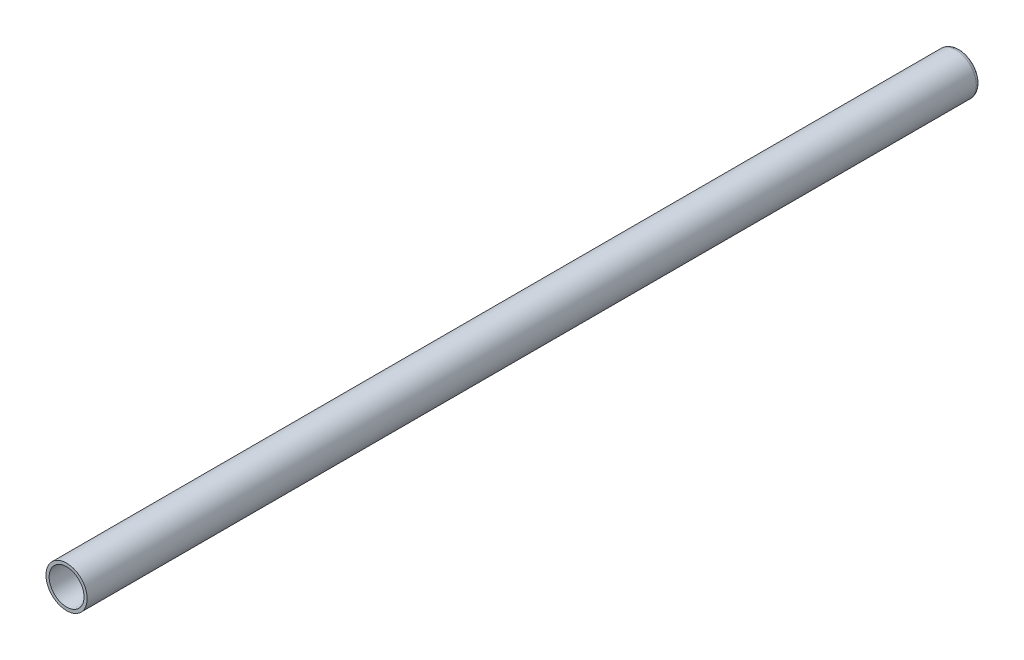
from build123d import *

# Parameters (mm, degrees)
CROQUIS2_R              = 15
SALIENTE_EXTRUIR1_DEPTH = 650
CROQUIS3_R              = 12.7
CORTAR_EXTRUIR1_DEPTH   = 640
REDONDEO1_R             = 3


with BuildPart() as part:
    # Croquis2 → Saliente-Extruir1 (new body)
    with BuildSketch(Plane.XY):
        Circle(CROQUIS2_R)
    extrude(amount=-SALIENTE_EXTRUIR1_DEPTH)

    # Croquis3 → Cortar-Extruir1 (cut)
    with BuildSketch(Plane.XY):
        Circle(CROQUIS3_R)
    extrude(amount=-CORTAR_EXTRUIR1_DEPTH, mode=Mode.SUBTRACT)

    # Redondeo1
    redondeo1_edges = [part.edges().sort_by_distance(p)[0] for p in [
        (-15, 0, -650),
    ]]
    fillet(redondeo1_edges, radius=REDONDEO1_R)


solid = part.part
